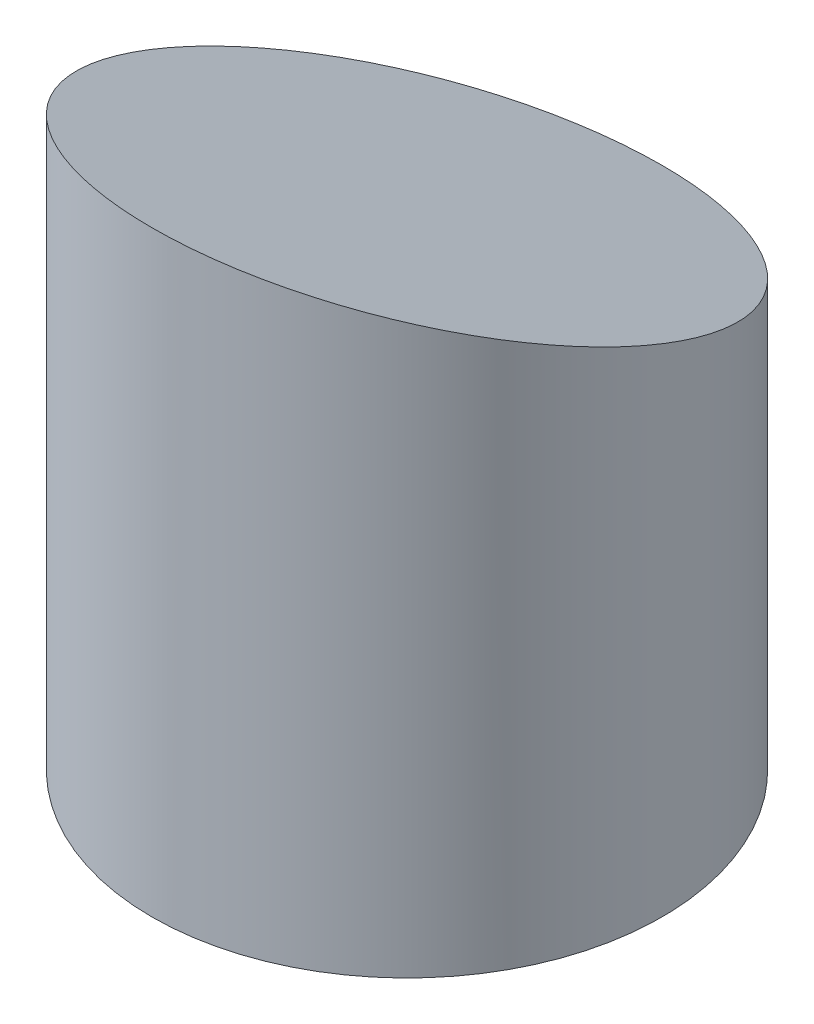
from build123d import *

# Parameters (mm, degrees)
SKETCH1_R           = 52.55
BOSS_EXTRUDE1_DEPTH = 123
SKETCH3_R           = 71.280097201
SKETCH3_R_2         = 54.5
CUT_EXTRUDE1_DEPTH  = 136.088476275


with BuildPart() as part:
    # Sketch1 → Boss-Extrude1 (new body)
    with BuildSketch(Plane(origin=(0, 0, 0), x_dir=(1, 0, 0), z_dir=(0, 1, 0))):
        with Locations(Location((0, 0, 0), (0, 0, 270))):
            Circle(SKETCH1_R)
    extrude(amount=BOSS_EXTRUDE1_DEPTH)

    # Sketch3 → Cut-Extrude1 (cut, through all)
    # profile 1 of 2: a face of its own
    with BuildSketch(Plane(origin=(5.59e-07, 88.558745739, -34.884217654), x_dir=(0, -0.366501226724298, -0.9304175679820244), z_dir=(5.869723517203529e-09, 0.9304175679820244, -0.366501226724298))):
        with Locations((-37.493077146, 0)):
            Circle(SKETCH3_R)
        with Locations((-37.493077146, 0)):
            Circle(SKETCH3_R_2, mode=Mode.SUBTRACT)
    # profile 2 of 2: a face of its own
    with BuildSketch(Plane(origin=(5.59e-07, 88.558745739, -34.884217654), x_dir=(0, -0.366501226724298, -0.9304175679820244), z_dir=(5.869723517203529e-09, 0.9304175679820244, -0.366501226724298))):
        with Locations((-37.493077146, 0)):
            Circle(SKETCH3_R_2)
    extrude(amount=CUT_EXTRUDE1_DEPTH, mode=Mode.SUBTRACT)


solid = part.part
